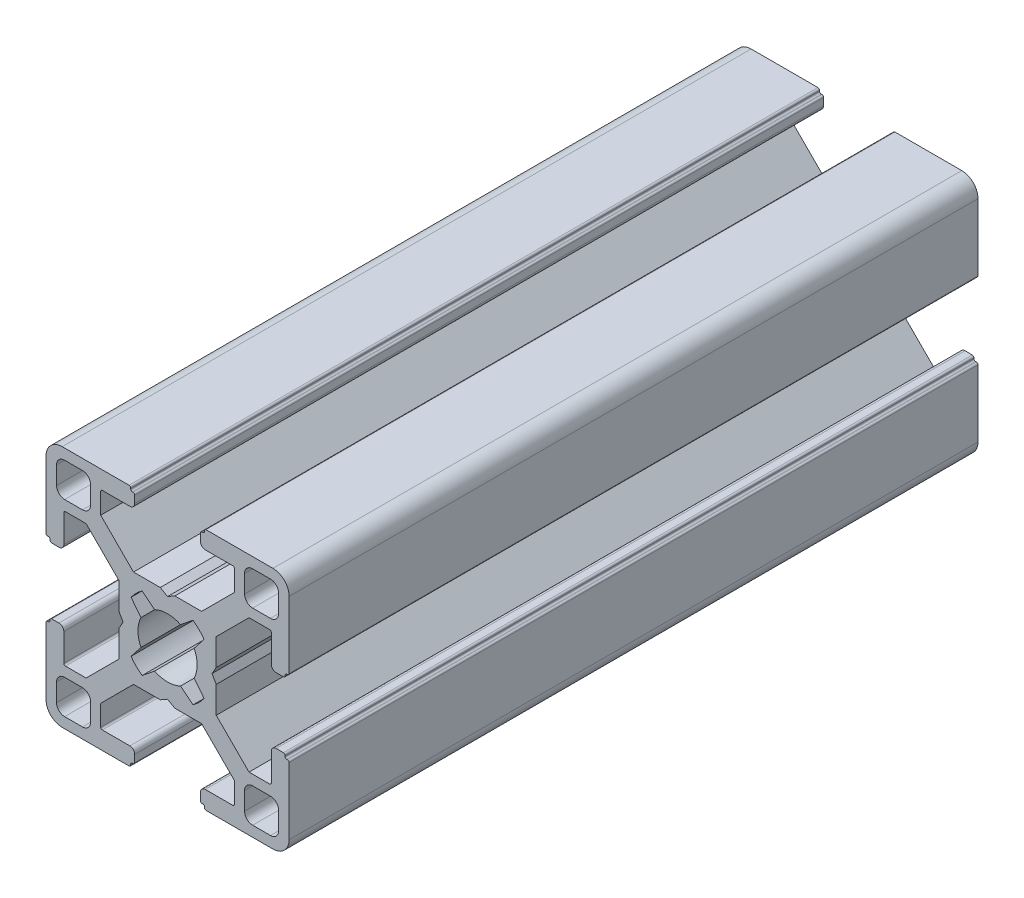
from build123d import *

# Parameters (mm, degrees)
BOSS_EXTRUDE1_DEPTH = 85


with BuildPart() as part:
    # Sketch1 → Boss-Extrude1 (new body)
    with BuildSketch(Plane.XY.offset(25)):
        with BuildLine():
            Line((-4.05, 13.399999434), (-4.05, 14.299999626))
            ThreePointArc((-4.05, 14.299999626), (-4.108578753, 14.441421247), (-4.250000374, 14.5))
            Line((-4.250000374, 14.5), (-4.350000144, 14.5))
            ThreePointArc((-4.350000144, 14.5), (-4.49142109, 14.558578474), (-4.549999564, 14.69999942))
            Line((-4.549999564, 14.69999942), (-4.549999564, 14.799999619))
            ThreePointArc((-4.549999564, 14.799999619), (-4.60857832, 14.941421245), (-4.749999945, 15))
            Line((-4.749999945, 15), (-13.000000346, 15))
            ThreePointArc((-13.000000346, 15), (-14.414213664, 14.414213664), (-15, 13.000000346))
            Line((-15, 13.000000346), (-15, 4.749999521))
            ThreePointArc((-15, 4.749999521), (-14.941421273, 4.608577964), (-14.799999716, 4.549999237))
            Line((-14.799999716, 4.549999237), (-14.700000611, 4.549999237))
            ThreePointArc((-14.700000611, 4.549999237), (-14.558579054, 4.49142051), (-14.500000327, 4.349998953))
            Line((-14.500000327, 4.349998953), (-14.500000327, 4.249999521))
            ThreePointArc((-14.500000327, 4.249999521), (-14.4414216, 4.108577964), (-14.300000043, 4.049999237))
            Line((-14.300000043, 4.049999237), (-13.39999994, 4.049999237))
            ThreePointArc((-13.39999994, 4.049999237), (-12.975735606, 4.225735278), (-12.799999564, 4.649999613))
            Line((-12.799999564, 4.649999613), (-12.799999564, 8.049999716))
            ThreePointArc((-12.799999564, 8.049999716), (-12.741420837, 8.191421273), (-12.59999928, 8.25))
            Line((-12.59999928, 8.25), (-10.049999564, 8.25))
            Line((-10.049999564, 8.25), (-6.00446543, 4.204465866))
            Line((-6.00446543, 4.204465866), (-6.00446543, 0.899999619))
            Line((-6.00446543, 0.899999619), (-5.484852164, 0))
            Line((-5.484852164, 0), (-6.00446543, -0.899999619))
            Line((-6.00446543, -0.899999619), (-6.00446543, -4.204465866))
            Line((-6.00446543, -4.204465866), (-10.049999564, -8.25))
            Line((-10.049999564, -8.25), (-12.59999928, -8.25))
            ThreePointArc((-12.59999928, -8.25), (-12.741420837, -8.191421273), (-12.799999564, -8.049999716))
            Line((-12.799999564, -8.049999716), (-12.799999564, -4.649999613))
            ThreePointArc((-12.799999564, -4.649999613), (-12.975735606, -4.225735278), (-13.39999994, -4.049999237))
            Line((-13.39999994, -4.049999237), (-14.300000043, -4.049999237))
            ThreePointArc((-14.300000043, -4.049999237), (-14.4414216, -4.108577964), (-14.500000327, -4.249999521))
            Line((-14.500000327, -4.249999521), (-14.500000327, -4.349998953))
            ThreePointArc((-14.500000327, -4.349998953), (-14.558579054, -4.49142051), (-14.700000611, -4.549999237))
            Line((-14.700000611, -4.549999237), (-14.799999716, -4.549999237))
            ThreePointArc((-14.799999716, -4.549999237), (-14.941421273, -4.608577964), (-15, -4.749999521))
            Line((-15, -4.749999521), (-15, -13.000000346))
            ThreePointArc((-15, -13.000000346), (-14.414213664, -14.414213664), (-13.000000346, -15))
            Line((-13.000000346, -15), (-4.749999945, -15))
            ThreePointArc((-4.749999945, -15), (-4.60857832, -14.941421245), (-4.549999564, -14.799999619))
            Line((-4.549999564, -14.799999619), (-4.549999564, -14.69999942))
            ThreePointArc((-4.549999564, -14.69999942), (-4.49142109, -14.558578474), (-4.350000144, -14.5))
            Line((-4.350000144, -14.5), (-4.250000374, -14.5))
            ThreePointArc((-4.250000374, -14.5), (-4.108578753, -14.441421247), (-4.05, -14.299999626))
            Line((-4.05, -14.299999626), (-4.05, -13.399999434))
            ThreePointArc((-4.05, -13.399999434), (-4.225735989, -12.975735226), (-4.650000197, -12.799999237))
            Line((-4.650000197, -12.799999237), (-8.049999924, -12.799999237))
            ThreePointArc((-8.049999924, -12.799999237), (-8.191421565, -12.741420475), (-8.250000327, -12.599998834))
            Line((-8.250000327, -12.599998834), (-8.250000327, -10.049999237))
            Line((-8.250000327, -10.049999237), (-4.204466193, -6))
            Line((-4.204466193, -6), (-0.899999946, -6))
            Line((-0.899999946, -6), (0, -5.484851837))
            Line((0, -5.484851837), (0.899999946, -6))
            Line((0.899999946, -6), (4.204466193, -6))
            Line((4.204466193, -6), (8.250000327, -10.049999237))
            Line((8.250000327, -10.049999237), (8.250000327, -12.599998834))
            ThreePointArc((8.250000327, -12.599998834), (8.191421565, -12.741420475), (8.049999924, -12.799999237))
            Line((8.049999924, -12.799999237), (4.650000197, -12.799999237))
            ThreePointArc((4.650000197, -12.799999237), (4.225735989, -12.975735226), (4.05, -13.399999434))
            Line((4.05, -13.399999434), (4.05, -14.299999626))
            ThreePointArc((4.05, -14.299999626), (4.108578753, -14.441421247), (4.250000374, -14.5))
            Line((4.250000374, -14.5), (4.350000144, -14.5))
            ThreePointArc((4.350000144, -14.5), (4.49142109, -14.558578474), (4.549999564, -14.69999942))
            Line((4.549999564, -14.69999942), (4.549999564, -14.799999619))
            ThreePointArc((4.549999564, -14.799999619), (4.60857832, -14.941421245), (4.749999945, -15))
            Line((4.749999945, -15), (13.000000346, -15))
            ThreePointArc((13.000000346, -15), (14.414213664, -14.414213664), (15, -13.000000346))
            Line((15, -13.000000346), (15, -4.749999521))
            ThreePointArc((15, -4.749999521), (14.941421273, -4.608577964), (14.799999716, -4.549999237))
            Line((14.799999716, -4.549999237), (14.700000611, -4.549999237))
            ThreePointArc((14.700000611, -4.549999237), (14.558579054, -4.49142051), (14.500000327, -4.349998953))
            Line((14.500000327, -4.349998953), (14.500000327, -4.249999521))
            ThreePointArc((14.500000327, -4.249999521), (14.4414216, -4.108577964), (14.300000043, -4.049999237))
            Line((14.300000043, -4.049999237), (13.39999994, -4.049999237))
            ThreePointArc((13.39999994, -4.049999237), (12.975735606, -4.225735278), (12.799999564, -4.649999613))
            Line((12.799999564, -4.649999613), (12.799999564, -8.049999716))
            ThreePointArc((12.799999564, -8.049999716), (12.741420837, -8.191421273), (12.59999928, -8.25))
            Line((12.59999928, -8.25), (10.049999564, -8.25))
            Line((10.049999564, -8.25), (6.00446543, -4.204465866))
            Line((6.00446543, -4.204465866), (6.00446543, -0.899999619))
            Line((6.00446543, -0.899999619), (5.484852164, 0))
            Line((5.484852164, 0), (6.00446543, 0.899999619))
            Line((6.00446543, 0.899999619), (6.00446543, 4.204465866))
            Line((6.00446543, 4.204465866), (10.049999564, 8.25))
            Line((10.049999564, 8.25), (12.59999928, 8.25))
            ThreePointArc((12.59999928, 8.25), (12.741420837, 8.191421273), (12.799999564, 8.049999716))
            Line((12.799999564, 8.049999716), (12.799999564, 4.649999613))
            ThreePointArc((12.799999564, 4.649999613), (12.975735606, 4.225735278), (13.39999994, 4.049999237))
            Line((13.39999994, 4.049999237), (14.300000043, 4.049999237))
            ThreePointArc((14.300000043, 4.049999237), (14.4414216, 4.108577964), (14.500000327, 4.249999521))
            Line((14.500000327, 4.249999521), (14.500000327, 4.349998953))
            ThreePointArc((14.500000327, 4.349998953), (14.558579054, 4.49142051), (14.700000611, 4.549999237))
            Line((14.700000611, 4.549999237), (14.799999716, 4.549999237))
            ThreePointArc((14.799999716, 4.549999237), (14.941421273, 4.608577964), (15, 4.749999521))
            Line((15, 4.749999521), (15, 13.000000346))
            ThreePointArc((15, 13.000000346), (14.414213664, 14.414213664), (13.000000346, 15))
            Line((13.000000346, 15), (4.749999945, 15))
            ThreePointArc((4.749999945, 15), (4.60857832, 14.941421245), (4.549999564, 14.799999619))
            Line((4.549999564, 14.799999619), (4.549999564, 14.69999942))
            ThreePointArc((4.549999564, 14.69999942), (4.49142109, 14.558578474), (4.350000144, 14.5))
            Line((4.350000144, 14.5), (4.250000374, 14.5))
            ThreePointArc((4.250000374, 14.5), (4.108578753, 14.441421247), (4.05, 14.299999626))
            Line((4.05, 14.299999626), (4.05, 13.399999434))
            ThreePointArc((4.05, 13.399999434), (4.225735989, 12.975735226), (4.650000197, 12.799999237))
            Line((4.650000197, 12.799999237), (8.049999924, 12.799999237))
            ThreePointArc((8.049999924, 12.799999237), (8.191421565, 12.741420475), (8.250000327, 12.599998834))
            Line((8.250000327, 12.599998834), (8.250000327, 10.049999237))
            Line((8.250000327, 10.049999237), (4.204466193, 6))
            Line((4.204466193, 6), (0.899999946, 6))
            Line((0.899999946, 6), (0, 5.484851837))
            Line((0, 5.484851837), (-0.899999946, 6))
            Line((-0.899999946, 6), (-4.204466193, 6))
            Line((-4.204466193, 6), (-8.250000327, 10.049999237))
            Line((-8.250000327, 10.049999237), (-8.250000327, 12.599998834))
            ThreePointArc((-8.250000327, 12.599998834), (-8.191421565, 12.741420475), (-8.049999924, 12.799999237))
            Line((-8.049999924, 12.799999237), (-4.650000197, 12.799999237))
            ThreePointArc((-4.650000197, 12.799999237), (-4.225735989, 12.975735226), (-4.05, 13.399999434))
        make_face()
        with BuildLine():
            Line((-12.7000011, 13.700000398), (-10.500000318, 13.700000398))
            ThreePointArc((-10.500000318, 13.700000398), (-9.792893543, 13.407107182), (-9.500000327, 12.700000408))
            Line((-9.500000327, 12.700000408), (-9.500000327, 10.499999626))
            ThreePointArc((-9.500000327, 10.499999626), (-9.792893543, 9.792892851), (-10.500000318, 9.499999635))
            Line((-10.500000318, 9.499999635), (-12.7000011, 9.499999635))
            ThreePointArc((-12.7000011, 9.499999635), (-13.407107874, 9.792892851), (-13.70000109, 10.499999626))
            Line((-13.70000109, 10.499999626), (-13.70000109, 12.700000408))
            ThreePointArc((-13.70000109, 12.700000408), (-13.407107874, 13.407107182), (-12.7000011, 13.700000398))
        make_face(mode=Mode.SUBTRACT)
        with BuildLine():
            Line((-10.500000318, -13.700000398), (-12.7000011, -13.700000398))
            ThreePointArc((-12.7000011, -13.700000398), (-13.407107874, -13.407107182), (-13.70000109, -12.700000408))
            Line((-13.70000109, -12.700000408), (-13.70000109, -10.499999626))
            ThreePointArc((-13.70000109, -10.499999626), (-13.407107874, -9.792892851), (-12.7000011, -9.499999635))
            Line((-12.7000011, -9.499999635), (-10.500000318, -9.499999635))
            ThreePointArc((-10.500000318, -9.499999635), (-9.792893543, -9.792892851), (-9.500000327, -10.499999626))
            Line((-9.500000327, -10.499999626), (-9.500000327, -12.700000408))
            ThreePointArc((-9.500000327, -12.700000408), (-9.792893543, -13.407107182), (-10.500000318, -13.700000398))
        make_face(mode=Mode.SUBTRACT)
        with BuildLine():
            Line((10.500000318, 13.700000398), (12.7000011, 13.700000398))
            ThreePointArc((12.7000011, 13.700000398), (13.407107874, 13.407107182), (13.70000109, 12.700000408))
            Line((13.70000109, 12.700000408), (13.70000109, 10.499999626))
            ThreePointArc((13.70000109, 10.499999626), (13.407107874, 9.792892851), (12.7000011, 9.499999635))
            Line((12.7000011, 9.499999635), (10.500000318, 9.499999635))
            ThreePointArc((10.500000318, 9.499999635), (9.792893543, 9.792892851), (9.500000327, 10.499999626))
            Line((9.500000327, 10.499999626), (9.500000327, 12.700000408))
            ThreePointArc((9.500000327, 12.700000408), (9.792893543, 13.407107182), (10.500000318, 13.700000398))
        make_face(mode=Mode.SUBTRACT)
        with BuildLine():
            Line((13.70000109, -10.499999626), (13.70000109, -12.700000408))
            ThreePointArc((13.70000109, -12.700000408), (13.407107874, -13.407107182), (12.7000011, -13.700000398))
            Line((12.7000011, -13.700000398), (10.500000318, -13.700000398))
            ThreePointArc((10.500000318, -13.700000398), (9.792893543, -13.407107182), (9.500000327, -12.700000408))
            Line((9.500000327, -12.700000408), (9.500000327, -10.499999626))
            ThreePointArc((9.500000327, -10.499999626), (9.792893543, -9.792892851), (10.500000318, -9.499999635))
            Line((10.500000318, -9.499999635), (12.7000011, -9.499999635))
            ThreePointArc((12.7000011, -9.499999635), (13.407107874, -9.792892851), (13.70000109, -10.499999626))
        make_face(mode=Mode.SUBTRACT)
        with BuildLine():
            Line((-3.135929412, 4.518400903), (-1.600129524, 3.280561767))
            ThreePointArc((-1.600129524, 3.280561767), (0, 3.65), (1.600129524, 3.280561767))
            Line((1.600129524, 3.280561767), (3.135929412, 4.518400903))
            ThreePointArc((3.135929412, 4.518400903), (3.881002259, 3.897155561), (4.505336892, 3.154669473))
            Line((4.505336892, 3.154669473), (3.280561732, 1.600129597))
            ThreePointArc((3.280561732, 1.600129597), (3.65, 0), (3.280561732, -1.600129597))
            Line((3.280561732, -1.600129597), (4.505336892, -3.154669473))
            ThreePointArc((4.505336892, -3.154669473), (3.881002259, -3.897155561), (3.135929412, -4.518400903))
            Line((3.135929412, -4.518400903), (1.600129524, -3.280561767))
            ThreePointArc((1.600129524, -3.280561767), (0, -3.65), (-1.600129524, -3.280561767))
            Line((-1.600129524, -3.280561767), (-3.135929412, -4.518400903))
            ThreePointArc((-3.135929412, -4.518400903), (-3.881002259, -3.897155561), (-4.505336892, -3.154669473))
            Line((-4.505336892, -3.154669473), (-3.280561732, -1.600129597))
            ThreePointArc((-3.280561732, -1.600129597), (-3.65, 0), (-3.280561732, 1.600129597))
            Line((-3.280561732, 1.600129597), (-4.505336892, 3.154669473))
            ThreePointArc((-4.505336892, 3.154669473), (-3.881002259, 3.897155561), (-3.135929412, 4.518400903))
        make_face(mode=Mode.SUBTRACT)
    extrude(amount=-BOSS_EXTRUDE1_DEPTH)


solid = part.part
